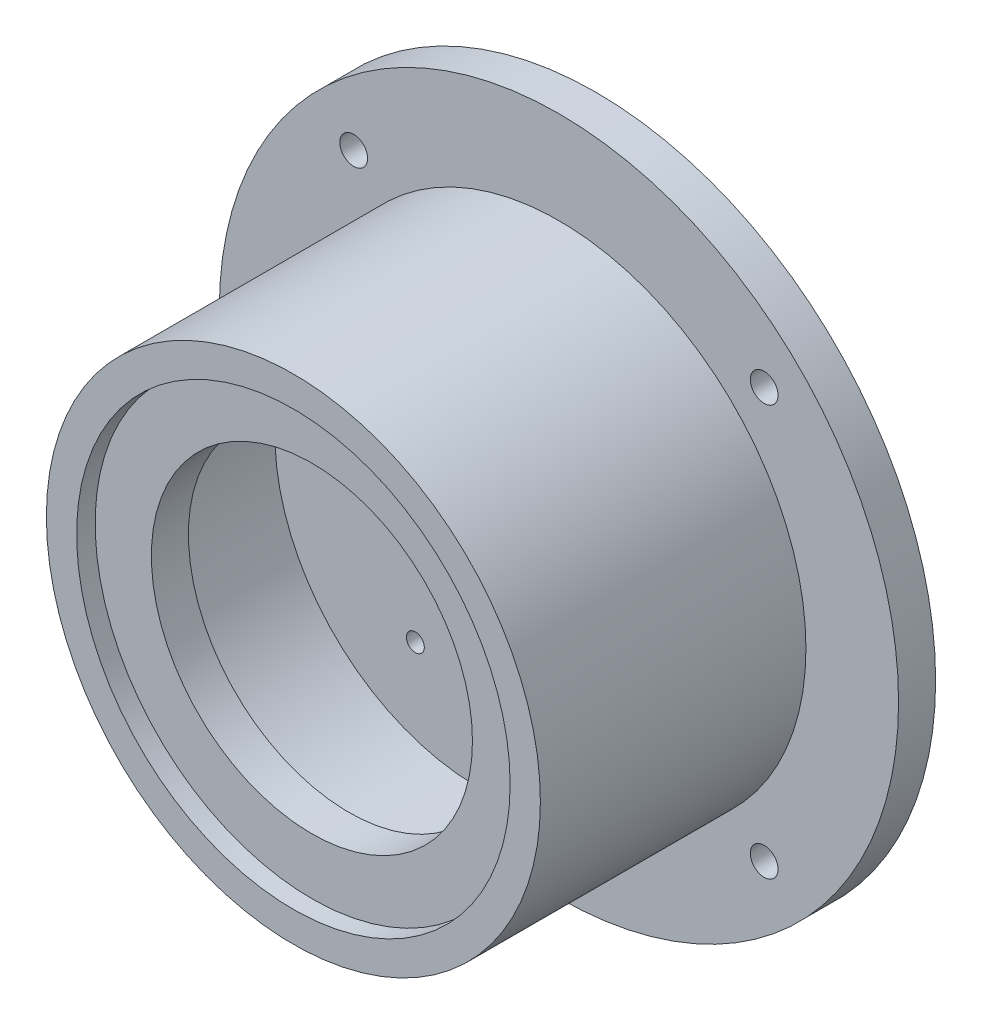
from build123d import *

# Parameters (mm, degrees)
BRIDA_START                               = 10
SK_BRIDA_R                                = 55
BRIDA_DEPTH                               = 6
TUBO_START                                = 16
SK_TUBO_R                                 = 40
SK_TUBO_R_2                               = 33
TUBO_DEPTH                                = 34
ARO_RODAMIENTO_START                      = 50
SK_ARO_RODAMIENTO_R                       = 40
SK_ARO_RODAMIENTO_R_2                     = 26
ARO_RODAMIENTO_DEPTH                      = 6
ASIENTO_ARANDELA_ALOJAMIENTO_51110_START  = 56
SK_ASIENTO_ARANDELA_ALOJAMIENTO_51110_R   = 40
SK_ASIENTO_ARANDELA_ALOJAMIENTO_51110_R_2 = 35.1
ASIENTO_ARANDELA_ALOJAMIENTO_51110_DEPTH  = 3
PLACA_MOTOR_START                         = 23
SK_PLACA_MOTOR_R                          = 33
PLACA_MOTOR_DEPTH                         = 6
HUECO_BRIDA_START                         = 10
SK_HUECO_BRIDA_R                          = 28
HUECO_BRIDA_DEPTH                         = 13
CENTRO_MOTOR_START                        = 23
SK_CENTRO_MOTOR_R                         = 8
CENTRO_MOTOR_DEPTH                        = 6
PASANTES_M2_5_MOTOR_START                 = 23
SK_PASANTES_M2_5_MOTOR_R                  = 1.45
PASANTES_M2_5_MOTOR_DEPTH                 = 6
PASANTES_M4_BRIDA_START                   = 10
SK_PASANTES_M4_BRIDA_R                    = 2.25
PASANTES_M4_BRIDA_DEPTH                   = 6


with BuildPart() as part:
    # Sk_Brida → Brida (new body)
    with BuildSketch(Plane.XY.offset(BRIDA_START)):
        Circle(SK_BRIDA_R)
    extrude(amount=BRIDA_DEPTH)

    # Sk_Tubo → Tubo (add)
    with BuildSketch(Plane.XY.offset(TUBO_START)):
        Circle(SK_TUBO_R)
        Circle(SK_TUBO_R_2, mode=Mode.SUBTRACT)
    extrude(amount=TUBO_DEPTH)

    # Sk_Aro_rodamiento → Aro_rodamiento (add)
    with BuildSketch(Plane.XY.offset(ARO_RODAMIENTO_START)):
        Circle(SK_ARO_RODAMIENTO_R)
        Circle(SK_ARO_RODAMIENTO_R_2, mode=Mode.SUBTRACT)
    extrude(amount=ARO_RODAMIENTO_DEPTH)

    # Sk_Asiento_arandela_alojamiento_51110 → Asiento_arandela_alojamiento_51110 (add)
    with BuildSketch(Plane.XY.offset(ASIENTO_ARANDELA_ALOJAMIENTO_51110_START)):
        Circle(SK_ASIENTO_ARANDELA_ALOJAMIENTO_51110_R)
        Circle(SK_ASIENTO_ARANDELA_ALOJAMIENTO_51110_R_2, mode=Mode.SUBTRACT)
    extrude(amount=ASIENTO_ARANDELA_ALOJAMIENTO_51110_DEPTH)

    # Sk_Placa_motor → Placa_motor (add)
    with BuildSketch(Plane.XY.offset(PLACA_MOTOR_START)):
        Circle(SK_PLACA_MOTOR_R)
    extrude(amount=PLACA_MOTOR_DEPTH)

    # Sk_Hueco_brida → Hueco_brida (cut)
    with BuildSketch(Plane.XY.offset(HUECO_BRIDA_START)):
        Circle(SK_HUECO_BRIDA_R)
    extrude(amount=HUECO_BRIDA_DEPTH, mode=Mode.SUBTRACT)

    # Sk_Centro_motor → Centro_motor (cut)
    with BuildSketch(Plane.XY.offset(CENTRO_MOTOR_START)):
        Circle(SK_CENTRO_MOTOR_R)
    extrude(amount=CENTRO_MOTOR_DEPTH, mode=Mode.SUBTRACT)

    # Sk_Pasantes_M2-5_motor → Pasantes_M2-5_motor (cut)
    with BuildSketch(Plane.XY.offset(PASANTES_M2_5_MOTOR_START)):
        with Locations((20.5, 0)):
            Circle(SK_PASANTES_M2_5_MOTOR_R)
        with Locations((10.25, 17.753520778)):
            Circle(SK_PASANTES_M2_5_MOTOR_R)
        with Locations((-10.25, 17.753520778)):
            Circle(SK_PASANTES_M2_5_MOTOR_R)
        with Locations((-20.5, 0)):
            Circle(SK_PASANTES_M2_5_MOTOR_R)
        with Locations((-10.25, -17.753520778)):
            Circle(SK_PASANTES_M2_5_MOTOR_R)
        with Locations((10.25, -17.753520778)):
            Circle(SK_PASANTES_M2_5_MOTOR_R)
    extrude(amount=PASANTES_M2_5_MOTOR_DEPTH, mode=Mode.SUBTRACT)

    # Sk_Pasantes_M4_brida → Pasantes_M4_brida (cut)
    with BuildSketch(Plane.XY.offset(PASANTES_M4_BRIDA_START)):
        with Locations((33.234018716, 33.234018716)):
            Circle(SK_PASANTES_M4_BRIDA_R)
        with Locations((-33.234018716, 33.234018716)):
            Circle(SK_PASANTES_M4_BRIDA_R)
        with Locations((-33.234018716, -33.234018716)):
            Circle(SK_PASANTES_M4_BRIDA_R)
        with Locations((33.234018716, -33.234018716)):
            Circle(SK_PASANTES_M4_BRIDA_R)
    extrude(amount=PASANTES_M4_BRIDA_DEPTH, mode=Mode.SUBTRACT)


solid = part.part
